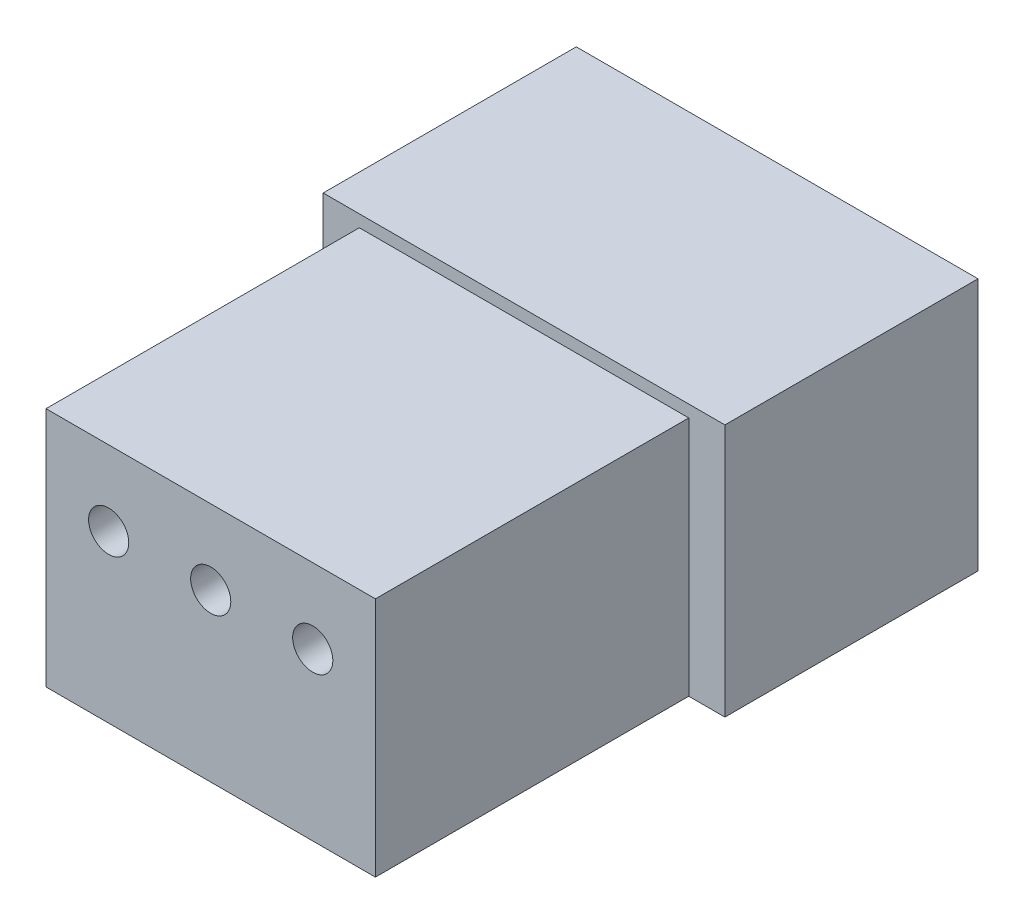
from build123d import *

# Parameters (mm, degrees)
SKETCH_1_W               = 10
SKETCH_1_H               = 6.3
SKETCH_1_W_2             = 8.6
SKETCH_1_H_2             = 3.9
EXTRUDE_1_DEPTH          = 6.3
SKETCH_2_W               = 8.2
SKETCH_2_H               = 6
EXTRUDE_2_DEPTH          = 7.8
SKETCH_3_W               = 10
SKETCH_3_H               = 6.3
EXTRUDE_3_DEPTH          = 1
CUT_EXTRUDE_1_DEPTH      = 19.398369493
CUT_EXTRUDE_1_DEPTH_BACK = 19.398369493
SKETCH_4_R               = 0.5


with BuildPart() as part:
    # 草图1 → 凸台-拉伸1 (new body)
    with BuildSketch(Plane.XY):
        with Locations((5, 3.15)):
            Rectangle(SKETCH_1_W, SKETCH_1_H)
        with Locations((5, 2.95)):
            Rectangle(SKETCH_1_W_2, SKETCH_1_H_2, mode=Mode.SUBTRACT)
    extrude(amount=EXTRUDE_1_DEPTH)

    # 草图2 → 凸台-拉伸2 (add)
    with BuildSketch(Plane.XY.offset(6.3)):
        with Locations((5, 3)):
            Rectangle(SKETCH_2_W, SKETCH_2_H)
    extrude(amount=EXTRUDE_2_DEPTH)

    # 草图3 → 凸台-拉伸3 (add)
    with BuildSketch(Plane(origin=(0, 0, 6.3), x_dir=(-1, 0, 0), z_dir=(0, 0, -1))):
        with Locations((-5, 3.15)):
            Rectangle(SKETCH_3_W, SKETCH_3_H)
    extrude(amount=EXTRUDE_3_DEPTH)

    # 草图4 → 切除-拉伸1 (cut, two sides: drawn at the far end of the back side and taken through both)
    with BuildSketch(Plane.XY.offset(14.1).offset(-CUT_EXTRUDE_1_DEPTH_BACK)):
        with Locations((2.46, 4.138210579)):
            Circle(SKETCH_4_R)
        with Locations((5, 4.138210579)):
            Circle(SKETCH_4_R)
        with Locations((7.54, 4.138210579)):
            Circle(SKETCH_4_R)
    extrude(amount=CUT_EXTRUDE_1_DEPTH + CUT_EXTRUDE_1_DEPTH_BACK, mode=Mode.SUBTRACT)


solid = part.part
